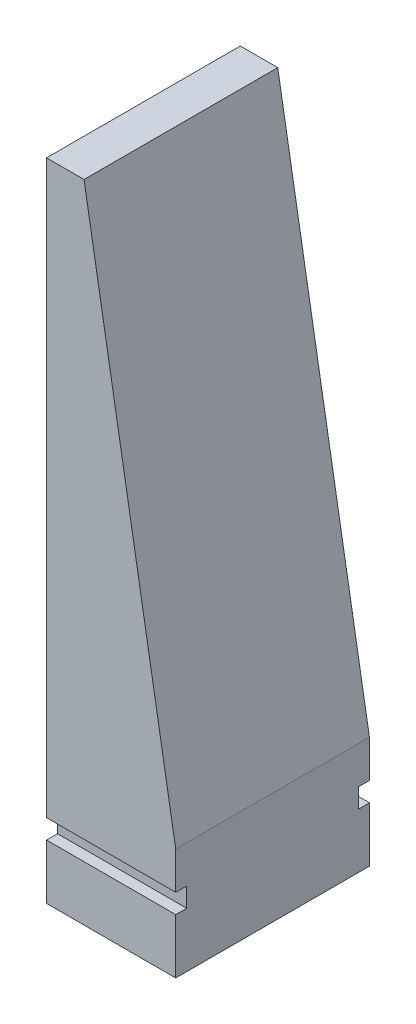
from build123d import *

# Parameters (mm, degrees)
SKETCH1_W           = 15
SKETCH1_H           = 50
BOSS_EXTRUDE1_DEPTH = 10
SKETCH2_W           = 0.85
SKETCH2_H           = 1.5
CUT_EXTRUDE1_DEPTH  = 52.53882032
CUT_EXTRUDE3_DEPTH  = 54.150729064


with BuildPart() as part:
    # Sketch1 → Boss-Extrude1 (new body)
    with BuildSketch(Plane(origin=(0, 0, 0), x_dir=(0, 0, -1), z_dir=(1, 0, 0))):
        with Locations((0, 25)):
            Rectangle(SKETCH1_W, SKETCH1_H)
    extrude(amount=BOSS_EXTRUDE1_DEPTH)

    # Sketch2 → Cut-Extrude1 (cut, through all)
    with BuildSketch(Plane(origin=(10, 0, 0), x_dir=(0, 0, -1), z_dir=(1, 0, 0))):
        with Locations((-7.075, 5)):
            Rectangle(SKETCH2_W, SKETCH2_H)
        with Locations((7.075, 5)):
            Rectangle(SKETCH2_W, SKETCH2_H)
    extrude(amount=-CUT_EXTRUDE1_DEPTH, mode=Mode.SUBTRACT)

    # Sketch3 → Cut-Extrude3 (cut, through all)
    with BuildSketch(Plane.XY.offset(7.5)):
        Polygon((2.90122494, 50), (10, 8.648873186), (10, 50), align=None)
    extrude(amount=-CUT_EXTRUDE3_DEPTH, mode=Mode.SUBTRACT)


solid = part.part
